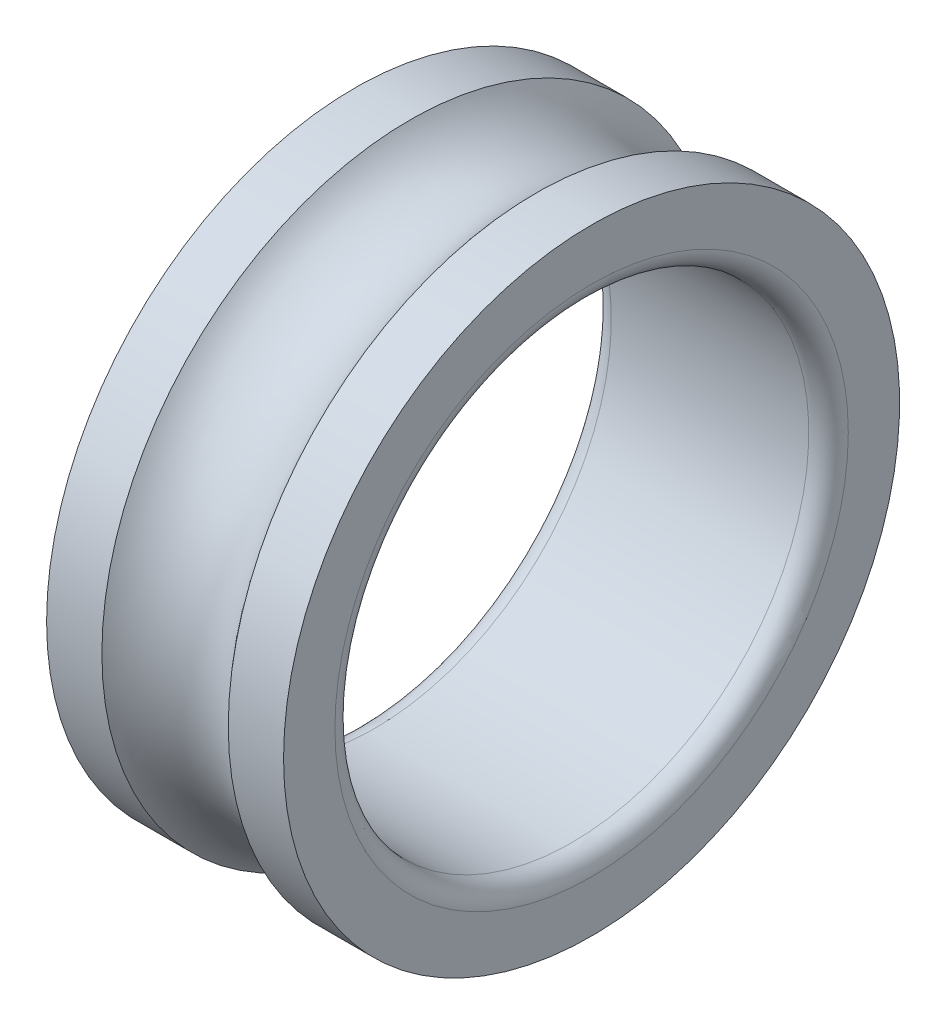
from build123d import *


with BuildPart() as part:
    # Esquisse1 → Base-Révolution (revolve)
    with BuildSketch(Plane.XY, mode=Mode.PRIVATE) as base_r_volution_sk:
        with BuildLine():
            Line((3, 6.5), (3, 7.8))
            Line((3, 7.8), (1.6, 7.8))
            ThreePointArc((1.6, 7.8), (0, 7), (-1.6, 7.8))
            Line((-1.6, 7.8), (-3, 7.8))
            Line((-3, 7.8), (-3, 6.5))
            ThreePointArc((-3, 6.5), (-2.853553391, 6.146446609), (-2.5, 6))
            Line((-2.5, 6), (2.5, 6))
            ThreePointArc((2.5, 6), (2.853553391, 6.146446609), (3, 6.5))
        make_face()
    revolve(base_r_volution_sk.sketch.rotate(Axis((-4.370908092, 0, 0), (1, 0, 0)), 90), axis=Axis((-4.370908092, 0, 0), (1, 0, 0)))


solid = part.part
